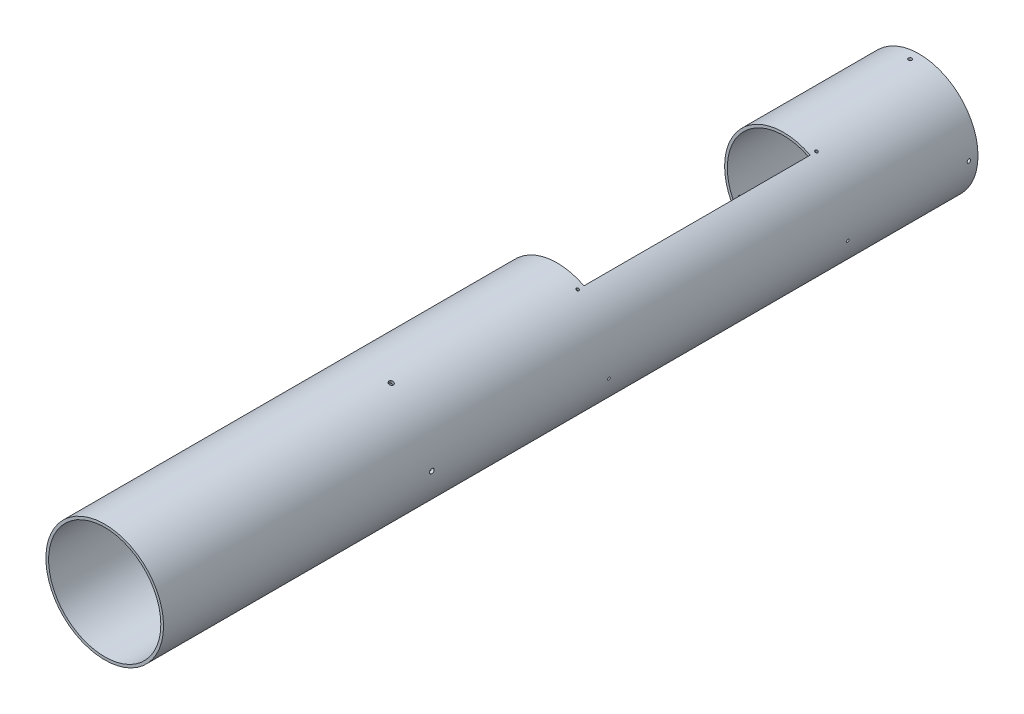
from build123d import *

# Parameters (mm, degrees)
SKETCH1_R           = 65
SKETCH1_R_2         = 62
BOSS_EXTRUDE1_DEPTH = 900
SKETCH4_W           = 130
SKETCH4_H           = 250
CUT_EXTRUDE4_DEPTH  = 516
SKETCH5_R           = 2
CUT_EXTRUDE5_DEPTH  = 85
CIRPATTERN1_COUNT   = 4
SKETCH7_R           = 1.5
CUT_EXTRUDE6_DEPTH  = 243
CIRPATTERN2_COUNT   = 5
SKETCH8_R           = 2.5
CUT_EXTRUDE7_DEPTH  = 209
CIRPATTERN3_COUNT   = 5


with BuildPart() as part:
    # Sketch1 → Boss-Extrude1 (new body)
    with BuildSketch(Plane.XY):
        Circle(SKETCH1_R)
        Circle(SKETCH1_R_2, mode=Mode.SUBTRACT)
    extrude(amount=BOSS_EXTRUDE1_DEPTH)

    # Sketch4 → Cut-Extrude4 (cut)
    with BuildSketch(Plane(origin=(-14.142135624, 14.142135624, 0), x_dir=(0.7071067811865477, 0.7071067811865475, 0), z_dir=(-0.7071067811865475, 0.7071067811865477, 0))):
        with Locations((0, -275)):
            Rectangle(SKETCH4_W, SKETCH4_H)
    extrude(amount=CUT_EXTRUDE4_DEPTH, mode=Mode.SUBTRACT)

    # Sketch5 → Cut-Extrude5 (cut)
    with BuildSketch(Plane(origin=(0, 0, 0), x_dir=(1, 0, 0), z_dir=(0, 1, 0))):
        with Locations(Location((0, -10, 0), (0, 0, 270))):
            Circle(SKETCH5_R)
    cut_extrude5 = extrude(amount=-CUT_EXTRUDE5_DEPTH, mode=Mode.SUBTRACT)

    # CirPattern1: Cut-Extrude5 ×4 about axis
    cirpattern1_axis = Axis((0, 0, 900), (0, 0, -1))
    for i in range(1, CIRPATTERN1_COUNT):
        add(cut_extrude5.rotate(cirpattern1_axis, i * 360 / CIRPATTERN1_COUNT), mode=Mode.SUBTRACT)

    # Sketch7 → Cut-Extrude6 (cut)
    with BuildSketch(Plane(origin=(-14.142135624, 14.142135624, 0), x_dir=(0.7071067811865477, 0.7071067811865475, 0), z_dir=(-0.7071067811865475, 0.7071067811865477, 0))):
        with Locations((0, -143)):
            Circle(SKETCH7_R)
        with Locations((0, -407)):
            Circle(SKETCH7_R)
    cut_extrude6 = extrude(amount=CUT_EXTRUDE6_DEPTH, mode=Mode.SUBTRACT)

    # CirPattern2: Cut-Extrude6 ×5 about axis
    cirpattern2_axis = Axis((0, 0, 900), (0, 0, -1))
    for i in range(1, CIRPATTERN2_COUNT):
        add(cut_extrude6.rotate(cirpattern2_axis, i * 360 / CIRPATTERN2_COUNT), mode=Mode.SUBTRACT)

    # Sketch8 → Cut-Extrude7 (cut)
    with BuildSketch(Plane(origin=(0, 0, 0), x_dir=(0, 0, -1), z_dir=(1, 0, 0))):
        with Locations(Location((-603.5, 0, 0), (0, 0, 180))):
            Circle(SKETCH8_R)
    cut_extrude7 = extrude(amount=CUT_EXTRUDE7_DEPTH, mode=Mode.SUBTRACT)

    # CirPattern3: Cut-Extrude7 ×5 about axis
    cirpattern3_axis = Axis((0, 0, 900), (0, 0, -1))
    for i in range(1, CIRPATTERN3_COUNT):
        add(cut_extrude7.rotate(cirpattern3_axis, i * 360 / CIRPATTERN3_COUNT), mode=Mode.SUBTRACT)


solid = part.part
